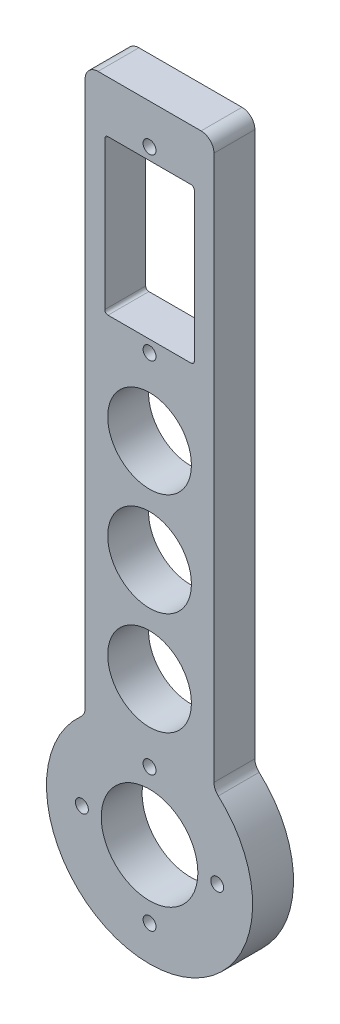
from build123d import *

# Parameters (mm, degrees)
SKETCH1_R           = 1
BOSS_EXTRUDE1_DEPTH = 3.175
SKETCH2_W           = 13.9
SKETCH2_H           = 24
SKETCH2_R           = 1
CUT_EXTRUDE1_DEPTH  = 102.470796291
FILLET1_R           = 0.5
FILLET2_R           = 2
SKETCH3_R           = 6.5
CUT_EXTRUDE2_DEPTH  = 6.35
SKETCH4_R           = 7.5
CUT_EXTRUDE3_DEPTH  = 102.470796291


with BuildPart() as part:
    # Sketch1 → Boss-Extrude1 (new, symmetric)
    with BuildSketch(Plane.XY):
        with BuildLine():
            Line((-10, 12.489995997), (-10, 100))
            Line((-10, 100), (10, 100))
            Line((10, 100), (10, 12.489995997))
            ThreePointArc((10, 12.489995997), (0, -16), (-10, 12.489995997))
        make_face()
        with Locations((-10.5, 0)):
            Circle(SKETCH1_R, mode=Mode.SUBTRACT)
        with Locations((0, 10.5)):
            Circle(SKETCH1_R, mode=Mode.SUBTRACT)
        with Locations((10.5, 0)):
            Circle(SKETCH1_R, mode=Mode.SUBTRACT)
        with Locations((0, -10.5)):
            Circle(SKETCH1_R, mode=Mode.SUBTRACT)
    extrude(amount=BOSS_EXTRUDE1_DEPTH, both=True)

    # Sketch2 → Cut-Extrude1 (cut, through all)
    with BuildSketch(Plane.XY.offset(3.175)):
        with Locations((0, 80)):
            Rectangle(SKETCH2_W, SKETCH2_H)
        with Locations((0, 66.15)):
            Circle(SKETCH2_R)
        with Locations((0, 93.85)):
            Circle(SKETCH2_R)
    extrude(amount=-CUT_EXTRUDE1_DEPTH, mode=Mode.SUBTRACT)

    # Fillet1
    fillet1_edges = [part.edges().sort_by_distance(p)[0] for p in [
        (6.95, 92, 0),
        (6.95, 68, 0),
        (-6.95, 68, 0),
        (-6.95, 92, 0),
    ]]
    fillet(fillet1_edges, radius=FILLET1_R)

    # Fillet2
    fillet2_edges = [part.edges().sort_by_distance(p)[0] for p in [
        (-10, 12.489995997, 0),
        (10, 12.489995997, 0),
        (10, 100, 0),
        (-10, 100, 0),
    ]]
    fillet(fillet2_edges, radius=FILLET2_R)

    # Sketch3 → Cut-Extrude2 (cut)
    with BuildSketch(Plane.XY.offset(3.175)):
        with Locations((0, 38.325)):
            Circle(SKETCH3_R)
        with Locations((0, 54.325)):
            Circle(SKETCH3_R)
        with Locations((0, 22.325)):
            Circle(SKETCH3_R)
    extrude(amount=-CUT_EXTRUDE2_DEPTH, mode=Mode.SUBTRACT)

    # Sketch4 → Cut-Extrude3 (cut, through all)
    with BuildSketch(Plane.XY.offset(3.175)):
        Circle(SKETCH4_R)
    extrude(amount=-CUT_EXTRUDE3_DEPTH, mode=Mode.SUBTRACT)


solid = part.part
